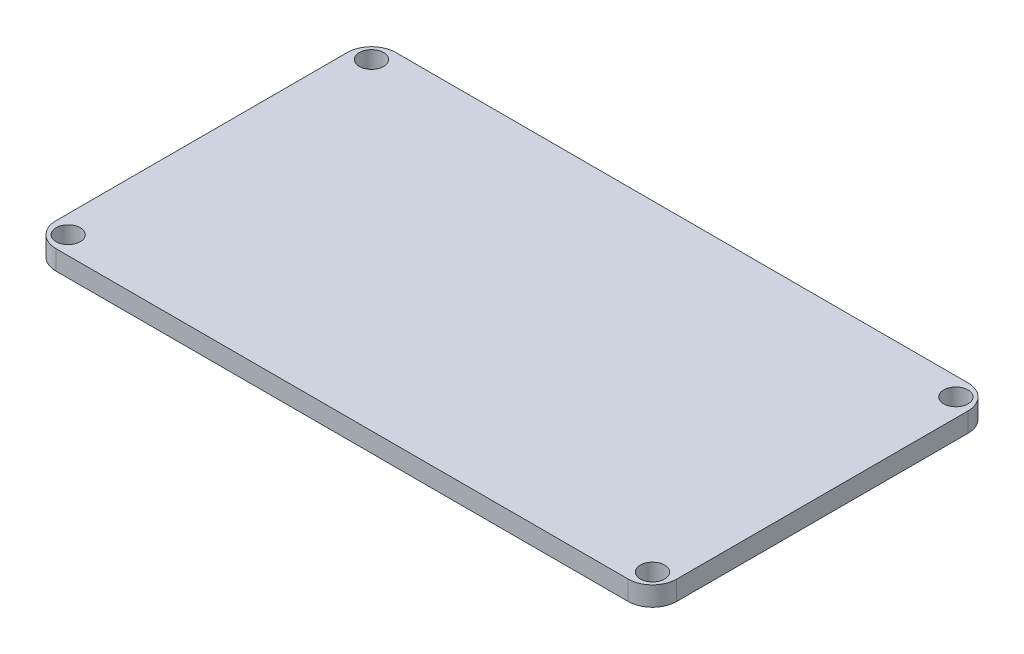
from build123d import *

# Parameters (mm, degrees)
SKETCH1_W           = 51.15
SKETCH1_H           = 28
BOSS_EXTRUDE1_DEPTH = 1.6
SKETCH2_R           = 1
CUT_EXTRUDE1_DEPTH  = 30.200010702
FILLET1_R           = 2
SKETCH3_W           = 18.25
SKETCH3_H           = 9
BOSS_EXTRUDE2_DEPTH = 2.36


with BuildPart() as part:
    # Sketch1 → Boss-Extrude1 (new body)
    with BuildSketch(Plane(origin=(0, 0, 0), x_dir=(1, 0, 0), z_dir=(0, 1, 0))):
        Rectangle(SKETCH1_W, SKETCH1_H)
    extrude(amount=BOSS_EXTRUDE1_DEPTH)

    # Sketch2 → Cut-Extrude1 (cut, through all)
    with BuildSketch(Plane(origin=(0, 1.6, 0), x_dir=(1, 0, 0), z_dir=(0, 1, 0))):
        with Locations((-24.075, 12.5)):
            Circle(SKETCH2_R)
        with Locations((24.075, 12.5)):
            Circle(SKETCH2_R)
        with Locations((24.075, -12.5)):
            Circle(SKETCH2_R)
        with Locations((-24.075, -12.5)):
            Circle(SKETCH2_R)
    extrude(amount=-CUT_EXTRUDE1_DEPTH, mode=Mode.SUBTRACT)

    # Fillet1
    fillet1_edges = [part.edges().sort_by_distance(p)[0] for p in [
        (25.575, 0.8, -14),
        (25.575, 0.8, 14),
        (-25.575, 0.8, 14),
        (-25.575, 0.8, -14),
    ]]
    fillet(fillet1_edges, radius=FILLET1_R)

    # Sketch3 → Boss-Extrude2 (add)
    with BuildSketch(Plane.XZ):
        Rectangle(SKETCH3_W, SKETCH3_H)
    extrude(amount=BOSS_EXTRUDE2_DEPTH)


solid = part.part
